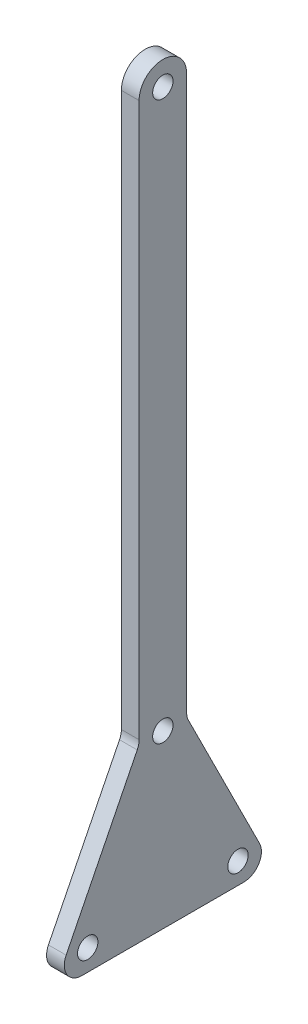
from build123d import *

# Parameters (mm, degrees)
SKETCH1_R           = 1.8288
BOSS_EXTRUDE1_DEPTH = 3.175
FILLET1_R           = 3.175


with BuildPart() as part:
    # Sketch1 → Boss-Extrude1 (new body)
    # profile 1 of 3: a face of its own
    with BuildSketch(Plane(origin=(0, 0, 0), x_dir=(0, 0, -1), z_dir=(1, 0, 0))):
        with BuildLine():
            Line((-19.639409497, -3.81), (19.639409497, -3.81))
            Line((19.639409497, -3.81), (4.259709497, 26.9494))
            ThreePointArc((4.259709497, 26.9494), (0, 22.689690503), (-4.259709497, 26.9494))
            Line((-4.259709497, 26.9494), (-19.639409497, -3.81))
        make_face()
        with Locations((-13.4747, 0)):
            Circle(SKETCH1_R, mode=Mode.SUBTRACT)
        with Locations((13.4747, 0)):
            Circle(SKETCH1_R, mode=Mode.SUBTRACT)
    # profile 2 of 3: a face of its own
    with BuildSketch(Plane(origin=(0, 0, 0), x_dir=(0, 0, -1), z_dir=(1, 0, 0))):
        with BuildLine():
            ThreePointArc((-4.259709497, 26.9494), (0, 22.689690503), (4.259709497, 26.9494))
            Line((4.259709497, 26.9494), (0, 35.468818994))
            Line((0, 35.468818994), (-4.259709497, 26.9494))
        make_face()
        with Locations((0, 26.9494)):
            Circle(SKETCH1_R, mode=Mode.SUBTRACT)
    # profile 3 of 3: a face of its own
    with BuildSketch(Plane(origin=(0, 0, 0), x_dir=(0, 0, -1), z_dir=(1, 0, 0))):
        with BuildLine():
            Line((0, 35.468818994), (4.259709497, 26.9494))
            Line((4.259709497, 26.9494), (4.259709497, 126.9494))
            ThreePointArc((4.259709497, 126.9494), (0, 131.209109497), (-4.259709497, 126.9494))
            Line((-4.259709497, 126.9494), (-4.259709497, 26.9494))
            Line((-4.259709497, 26.9494), (0, 35.468818994))
        make_face()
        with Locations((0, 126.9494)):
            Circle(SKETCH1_R, mode=Mode.SUBTRACT)
    extrude(amount=BOSS_EXTRUDE1_DEPTH)

    # Fillet1
    fillet1_edges = [part.edges().sort_by_distance(p)[0] for p in [
        (1.5875, -3.81, -19.639409497),
        (1.5875, -3.81, 19.639409497),
        (1.5875, 26.9494, 4.259709497),
        (1.5875, 26.9494, -4.259709497),
    ]]
    fillet(fillet1_edges, radius=FILLET1_R)


solid = part.part
